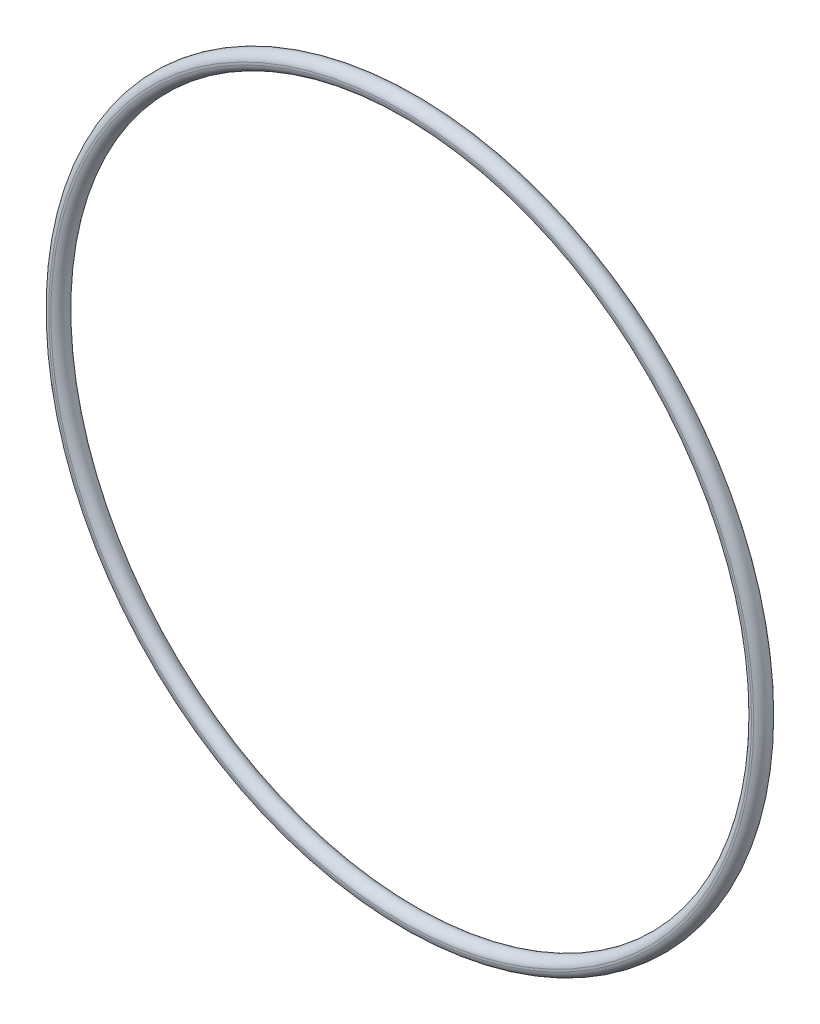
from build123d import *

# Parameters (mm, degrees)
SKETCH1_W = 0.675038158
SKETCH1_H = 5.291113256


with BuildPart() as part:
    # Sketch1 → Revolve1 (revolve)
    with BuildSketch(Plane(origin=(0, 0, 0), x_dir=(0, -1, 0), z_dir=(1, 0, 0)), mode=Mode.PRIVATE) as revolve1_sk:
        with BuildLine():
            ThreePointArc((106.786980921, 2.645556628), (104.4575, 0), (106.786980921, -2.645556628))
            Line((106.786980921, -2.645556628), (106.786980921, 2.645556628))
        make_face()
        with Locations((107.1245, 0)):
            Rectangle(SKETCH1_W, SKETCH1_H)
        with BuildLine():
            Line((107.462019079, 2.645556628), (107.462019079, -2.645556628))
            ThreePointArc((107.462019079, -2.645556628), (109.126130883, -1.762487676), (109.7915, 0))
            ThreePointArc((109.7915, 0), (109.126130883, 1.762487676), (107.462019079, 2.645556628))
        make_face()
    revolve(revolve1_sk.sketch.rotate(Axis((0, 0, 2.667), (0, 0, -1)), 270), axis=Axis((0, 0, 2.667), (0, 0, -1)))


solid = part.part
